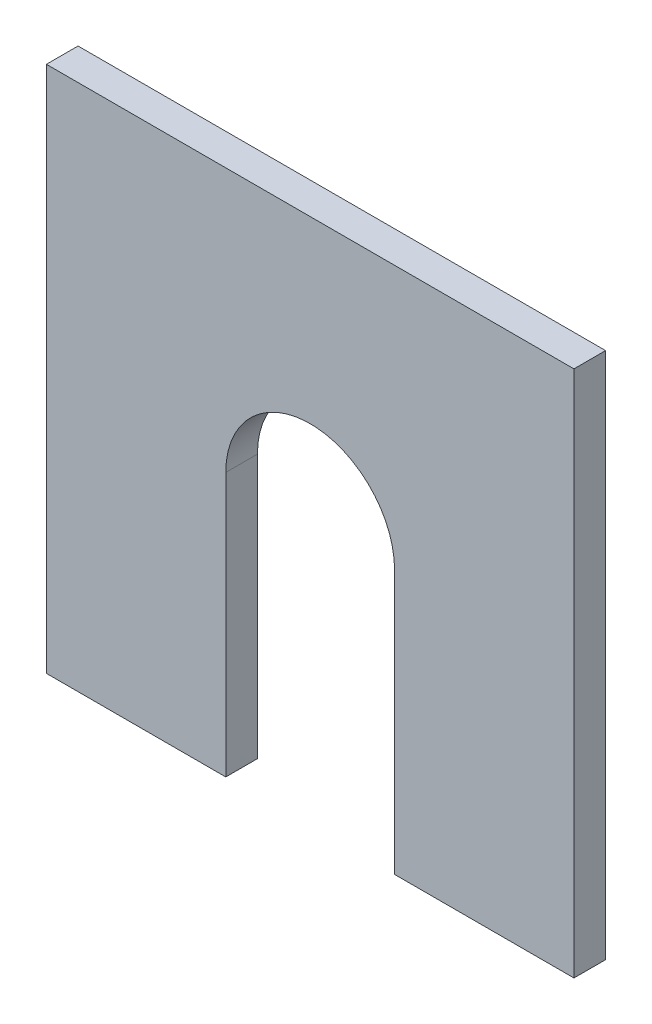
from build123d import *

# Parameters (mm, degrees)
SCHIZZO1_W                   = 25
SCHIZZO1_H                   = 25
ESTRUSIONE_ESTRUSIONE1_DEPTH = 1.5
TAGLIO_ESTRUSIONE1_DEPTH     = 18.741194999


with BuildPart() as part:
    # Schizzo1 → Estrusione-Estrusione1 (new body)
    with BuildSketch(Plane.XY):
        Rectangle(SCHIZZO1_W, SCHIZZO1_H)
    extrude(amount=ESTRUSIONE_ESTRUSIONE1_DEPTH)

    # Schizzo2 → Taglio-Estrusione1 (cut, through all)
    with BuildSketch(Plane.XY.offset(1.5)):
        with BuildLine():
            Line((-4, 0), (-4, -12.5))
            Line((-4, -12.5), (4, -12.5))
            Line((4, -12.5), (4, 0))
            ThreePointArc((4, 0), (0, 4), (-4, 0))
        make_face()
    extrude(amount=-TAGLIO_ESTRUSIONE1_DEPTH, mode=Mode.SUBTRACT)


solid = part.part
